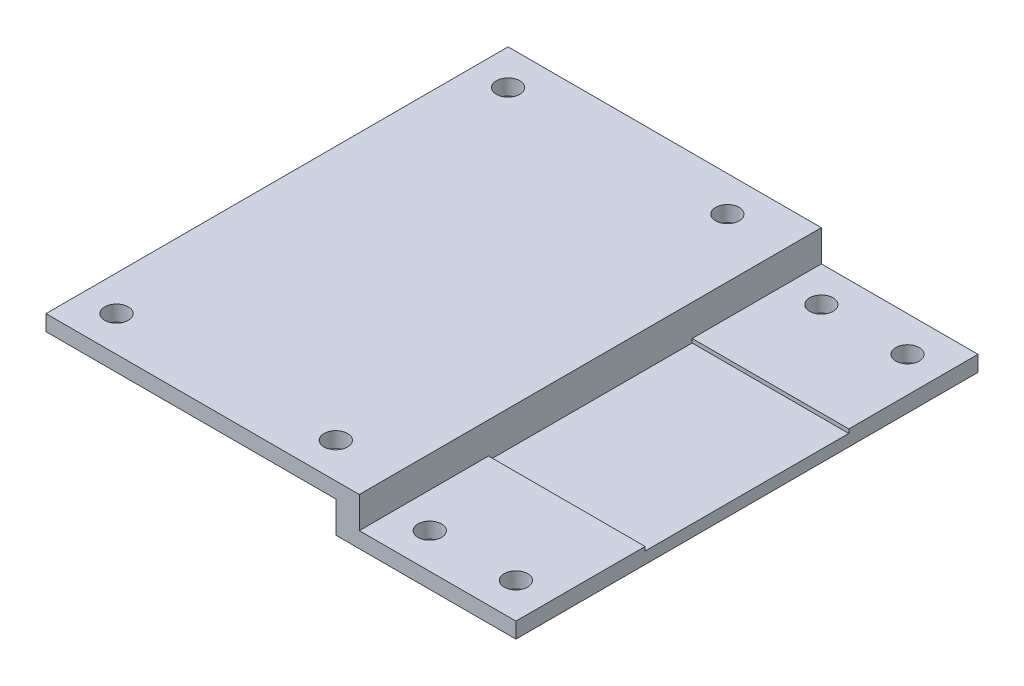
from build123d import *

# Parameters (mm, degrees)
SKETCH_1_W          = 62
SKETCH_1_H          = 59
EXTRUDE_1_DEPTH     = 2
SKETCH_2_W          = 3
SKETCH_2_H          = 59
EXTRUDE_2_DEPTH     = 4
SKETCH_3_W          = 59
SKETCH_3_H          = 2
EXTRUDE_3_DEPTH     = 20
HOLE_WIZARD_M3_2_D  = 3
HOLE_WIZARD_M3_1_D  = 3
SKETCH_6_R          = 1.5
CUT_EXTRUDE_3_DEPTH = 10
SKETCH_7_W          = 59
SKETCH_7_H          = 2
CUT_EXTRUDE_4_DEPTH = 22
HOLE_WIZARD_M3_3_D  = 3
CUT_EXTRUDE_6_DEPTH = 0.5


with BuildPart() as part:
    # 草图1 → 凸台-拉伸1 (new body)
    with BuildSketch(Plane(origin=(0, 0, 0), x_dir=(1, 0, 0), z_dir=(0, 1, 0))):
        Rectangle(SKETCH_1_W, SKETCH_1_H)
    extrude(amount=EXTRUDE_1_DEPTH)

    # 草图2 → 凸台-拉伸2 (add)
    with BuildSketch(Plane.XZ):
        with Locations((29.5, 0)):
            Rectangle(SKETCH_2_W, SKETCH_2_H)
    extrude(amount=EXTRUDE_2_DEPTH)

    # 草图3 → 凸台-拉伸3 (add)
    with BuildSketch(Plane(origin=(31, 0, 0), x_dir=(0, 0, -1), z_dir=(1, 0, 0))):
        with Locations((0, -3)):
            Rectangle(SKETCH_3_W, SKETCH_3_H)
    extrude(amount=EXTRUDE_3_DEPTH)

    # M3 螺纹孔2 (through all)
    with Locations(Plane(origin=(23.5, 2, -25), x_dir=(0, 0, 1), z_dir=(0, 1, 0))):
        with Locations((0, 0), (50, 0)):
            Hole(HOLE_WIZARD_M3_2_D / 2)

    # M3 螺纹孔1 (through all)
    with Locations(Plane(origin=(35.5, -2, -25), x_dir=(0, 0, 1), z_dir=(0, 1, 0))):
        with Locations((0, 0), (0, 11), (50, 0), (50, 11)):
            Hole(HOLE_WIZARD_M3_1_D / 2)

    # 草图6 → 切除-拉伸3 (cut)
    with BuildSketch(Plane(origin=(0, 2, 0), x_dir=(1, 0, 0), z_dir=(0, 1, 0))):
        with Locations((-26.5, 25)):
            Circle(SKETCH_6_R)
        with Locations((-26.5, -25)):
            Circle(SKETCH_6_R)
    extrude(amount=-CUT_EXTRUDE_3_DEPTH, mode=Mode.SUBTRACT)

    # 草图7 → 切除-拉伸4 (cut)
    with BuildSketch(Plane.ZY.offset(31)):
        with Locations((0, 1)):
            Rectangle(SKETCH_7_W, SKETCH_7_H)
    extrude(amount=-CUT_EXTRUDE_4_DEPTH, mode=Mode.SUBTRACT)

    # M3 螺纹孔3 (through all)
    with Locations(Plane(origin=(-4.5, 2, -25), x_dir=(0, 0, 1), z_dir=(0, 1, 0))):
        with Locations((0, 0), (50, 0)):
            Hole(HOLE_WIZARD_M3_3_D / 2)

    # 草图9 → 切除-拉伸6 (cut)
    with BuildSketch(Plane(origin=(0, -2, 0), x_dir=(1, 0, 0), z_dir=(0, 1, 0))):
        Polygon((51, -13), (51, 0), (51, 13), (31, 13), (31, -13), align=None)
    extrude(amount=-CUT_EXTRUDE_6_DEPTH, mode=Mode.SUBTRACT)


solid = part.part
